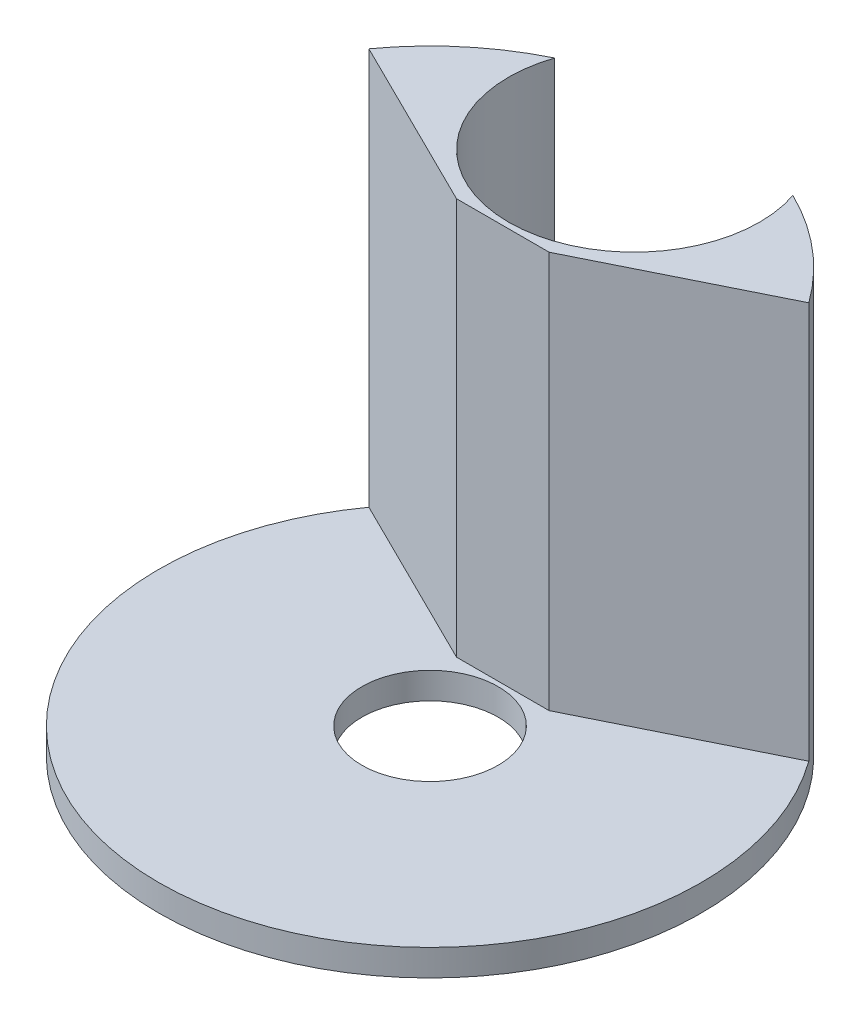
from build123d import *

# Parameters (mm, degrees)
SKETCH1_R           = 20.5
BOSS_EXTRUDE1_DEPTH = 2
SKETCH2_R           = 5.15
CUT_EXTRUDE1_DEPTH  = 3
SKETCH3_R           = 6.5
CUT_EXTRUDE2_DEPTH  = 2
BOSS_EXTRUDE4_DEPTH = 30


with BuildPart() as part:
    # Sketch1 → Boss-Extrude1 (new body)
    with BuildSketch(Plane(origin=(0, 0, 0), x_dir=(1, 0, 0), z_dir=(0, 1, 0))):
        with Locations(Location((0, 0, 0), (0, 0, 270))):
            Circle(SKETCH1_R)
    extrude(amount=BOSS_EXTRUDE1_DEPTH)

    # Sketch2 → Cut-Extrude1 (cut)
    with BuildSketch(Plane(origin=(0, 2, 0), x_dir=(1, 0, 0), z_dir=(0, 1, 0))):
        with Locations(Location((0, 0, 0), (0, 0, 270))):
            Circle(SKETCH2_R)
    extrude(amount=-CUT_EXTRUDE1_DEPTH, mode=Mode.SUBTRACT)

    # Sketch3 → Cut-Extrude2 (cut)
    with BuildSketch(Plane(origin=(0, 2, 0), x_dir=(1, 0, 0), z_dir=(0, 1, 0))):
        with Locations(Location((0, 13, 0), (0, 0, 270))):
            Circle(SKETCH3_R)
    extrude(amount=-CUT_EXTRUDE2_DEPTH, mode=Mode.SUBTRACT)

    # Sketch4 → Boss-Extrude4 (add)
    with BuildSketch(Plane(origin=(0, 2, 0), x_dir=(1, 0, 0), z_dir=(0, 1, 0))):
        with BuildLine():
            Line((-16.620770139, 12), (-3.5, 5.5))
            Line((-3.5, 5.5), (3.5, 5.5))
            Line((3.5, 5.5), (16.620770139, 12))
            ThreePointArc((16.620770139, 12), (13.206287248, 15.679412525), (9, 18.418740456))
            ThreePointArc((9, 18.418740456), (0, 5.93152382), (-9, 18.418740456))
            ThreePointArc((-9, 18.418740456), (-13.206287248, 15.679412525), (-16.620770139, 12))
        make_face()
    extrude(amount=BOSS_EXTRUDE4_DEPTH)


solid = part.part
